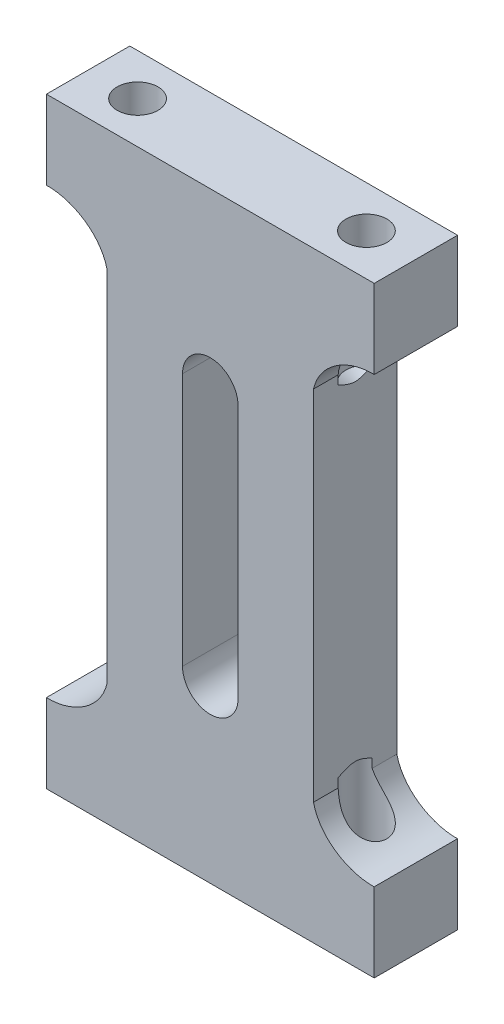
from build123d import *

# Parameters (mm, degrees)
ESTRUSIONE_ESTRUSIONE1_DEPTH       = 5.1
FORO_FILETTATO_M3X0_5_1_AT_2_COUNT = 2
FORO_FILETTATO_M3X0_5_1_AT_2_PITCH = 14


with BuildPart() as part:
    # Schizzo1 → Estrusione-Estrusione1 (new body)
    with BuildSketch(Plane.XY):
        with BuildLine():
            Line((37.65394009, 53.683010839), (17.60394009, 53.683010839))
            Line((17.60394009, 53.683010839), (17.60394009, 48.851504979))
            add(Edge.make_bspline(
                [(21.317368868, 46.227364164), (20.952056874, 47.845897177), (19.207385128, 48.898989615), (17.60394009, 48.851504979)],
                knots=[0, 0, 0, 0, 1, 1, 1, 1], degree=3))
            Line((21.317368868, 46.227364164), (21.317368868, 24.338657514))
            add(Edge.make_bspline(
                [(21.317368868, 24.338657514), (20.952056874, 22.720124501), (19.207385128, 21.667032063), (17.60394009, 21.714516699)],
                knots=[0, 0, 0, 0, 1, 1, 1, 1], degree=3))
            Line((17.60394009, 21.714516699), (17.60394009, 16.883010839))
            Line((17.60394009, 16.883010839), (37.65394009, 16.883010839))
            Line((37.65394009, 16.883010839), (37.65394009, 21.714516699))
            add(Edge.make_bspline(
                [(33.940511311, 24.338657514), (34.305823306, 22.720124501), (36.050495052, 21.667032063), (37.65394009, 21.714516699)],
                knots=[0, 0, 0, 0, 1, 1, 1, 1], degree=3))
            Line((33.940511311, 24.338657514), (33.940511311, 46.227364164))
            add(Edge.make_bspline(
                [(33.940511311, 46.227364164), (34.305823306, 47.845897177), (36.050495052, 48.898989615), (37.65394009, 48.851504979)],
                knots=[0, 0, 0, 0, 1, 1, 1, 1], degree=3))
            Line((37.65394009, 48.851504979), (37.65394009, 53.683010839))
        make_face()
        with BuildLine():
            ThreePointArc((25.92894009, 43.033010839), (27.62894009, 44.733010839), (29.32894009, 43.033010839))
            Line((29.32894009, 43.033010839), (29.32894009, 27.533010839))
            ThreePointArc((29.32894009, 27.533010839), (27.62894009, 25.833010839), (25.92894009, 27.533010839))
            Line((25.92894009, 27.533010839), (25.92894009, 43.033010839))
        make_face(mode=Mode.SUBTRACT)
    extrude(amount=ESTRUSIONE_ESTRUSIONE1_DEPTH)

    # Schizzo2 → Foro filettato M3x0.5-1 (revolve, cut)
    with BuildSketch(Plane(origin=(20.62894009, 53.683010839, 2.55), x_dir=(0, 0, 1), z_dir=(1, 0, 0))):
        Polygon((0, 0), (0, 8.751075774), (1.25, 8), (1.25, 0), align=None)
    foro_filettato_m3x0_5_1 = revolve(axis=Axis((20.62894009, 60.033010839, 2.55), (0, -1, 0)), mode=Mode.SUBTRACT)

    # Foro filettato M3x0.5-1 at 2: Foro filettato M3x0.5-1 ×2
    with Locations(*[(i * FORO_FILETTATO_M3X0_5_1_AT_2_PITCH, 0, 0) for i in range(1, FORO_FILETTATO_M3X0_5_1_AT_2_COUNT)]):
        add(foro_filettato_m3x0_5_1, mode=Mode.SUBTRACT)

    # Specchia1: Foro filettato M3x0.5-1 across plane
    add(foro_filettato_m3x0_5_1.mirror(Plane.ZX.offset(35.283010839)), mode=Mode.SUBTRACT)

    # Specchia1 copy 1 sketch → Specchia1 copy 1 (revolve, cut)
    with BuildSketch(Plane(origin=(34.62894009, 16.883010839, 2.55), x_dir=(0, 0, 1), z_dir=(1, 0, 0))):
        Polygon((0, 0), (0, -8.751075774), (1.25, -8), (1.25, 0), align=None)
    revolve(axis=Axis((34.62894009, 10.533010839, 2.55), (0, -1, 0)), mode=Mode.SUBTRACT)


solid = part.part
